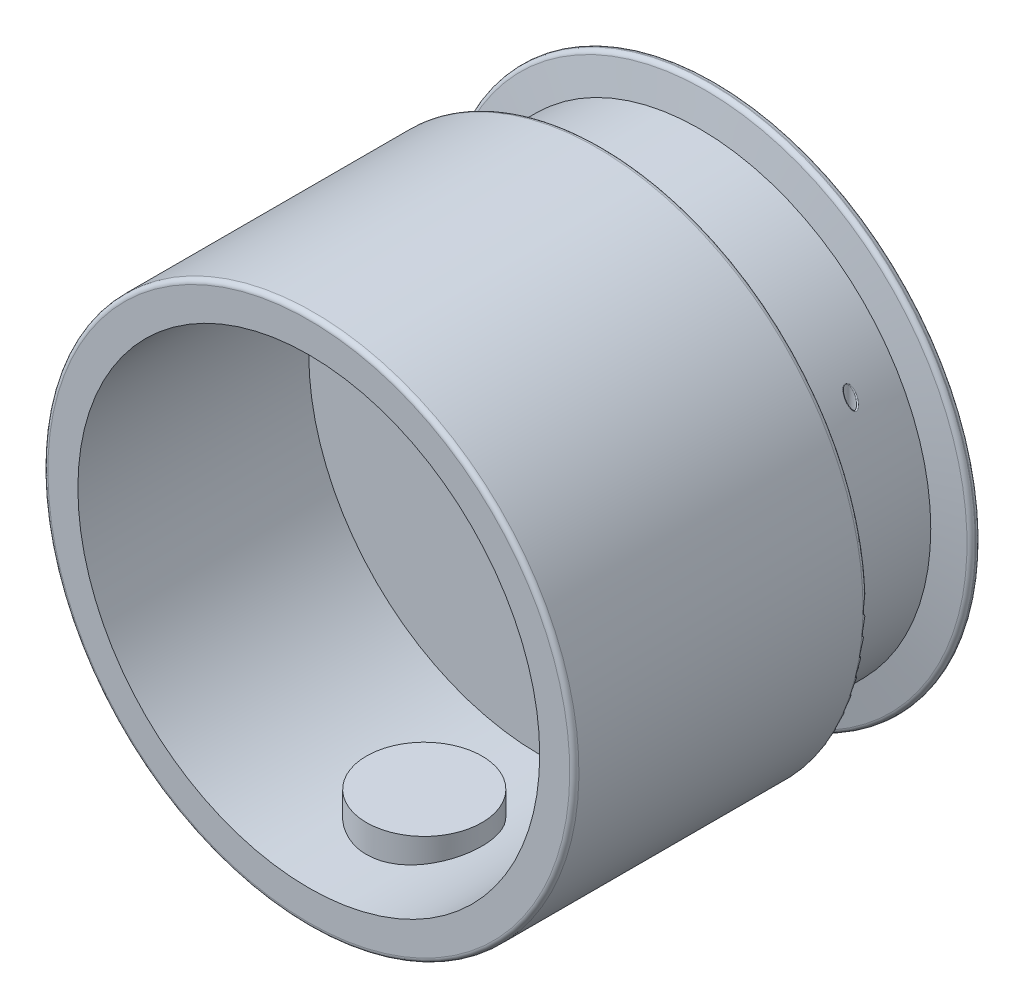
from build123d import *

# Parameters (mm, degrees)
BOSS_EXTRUDE1_REACH             = 13.742
BOSS_EXTRUDE1_DIRECTION_2_REACH = 13.742
FILLET2_R                       = 0.127
CUT_EXTRUDE1_START              = -6.35
SKETCH5_R                       = 6.35
CUT_EXTRUDE1_DEPTH              = 6.35
CHAMFER1_SIZE                   = 0.254
BOSS_EXTRUDE2_REACH             = 19.33
BOSS_EXTRUDE2_END_RADIUS        = 6.35
BOSS_EXTRUDE2_START             = -5.588
SKETCH7_R                       = 1.5875
CUT_EXTRUDE3_DEPTH              = 12.742178696
CUT_EXTRUDE3_DEPTH_BACK         = 12.742178696
SKETCH8_R                       = 0.127
FILLET4_R                       = 0.0254


with BuildPart() as part:
    # Sketch3 → Revolve1 (revolve)
    with BuildSketch(Plane(origin=(0, 0, 0), x_dir=(0, 0, -1), z_dir=(1, 0, 0))):
        Polygon((5.588, 1.7145), (-5.588, 1.7145), (-5.588, 7.3025), (2.458097102, 7.3025), (2.626048551, 6.35), (5.166048551, 6.35), (5.334, 7.3025), (5.588, 7.3025), align=None)
    revolve(axis=Axis((0, 0, 0), (0, 0, 1)))

    # Boss-Extrude1: up to this face of the body (flat: up to its plane)
    boss_extrude1_end = Plane(part.part.faces().sort_by_distance((0, -1.921045891, 5.588))[0])
    # Sketch4 → Boss-Extrude1 (add, up to the picked face)
    with BuildSketch(Plane.XY, mode=Mode.PRIVATE) as boss_extrude1_sk1:
        with BuildLine():
            Line((-1.516360854, 0.8001), (1.516360854, 0.8001))
            ThreePointArc((1.516360854, 0.8001), (0, 1.7145), (-1.516360854, 0.8001))
        make_face()
    boss_extrude1_tool1 = split(extrude(boss_extrude1_sk1.sketch, amount=BOSS_EXTRUDE1_REACH, mode=Mode.PRIVATE), bisect_by=boss_extrude1_end, keep=Keep.BOTH, mode=Mode.PRIVATE)
    add(boss_extrude1_tool1.solids().sort_by(Axis((0, 1.175768, 0), (0, 0, 1)))[0])

    # Boss-Extrude1 direction 2: up to this face of the body (flat: up to its plane)
    boss_extrude1_direction_2_end = Plane(part.part.faces().sort_by_distance((0, -7.095954109, -5.588))[0])
    # Sketch4 → Boss-Extrude1 direction 2 (add, up to the picked face)
    with BuildSketch(Plane.XY, mode=Mode.PRIVATE) as boss_extrude1_direction_2_sk1:
        with BuildLine():
            Line((-1.516360854, 0.8001), (1.516360854, 0.8001))
            ThreePointArc((1.516360854, 0.8001), (0, 1.7145), (-1.516360854, 0.8001))
        make_face()
    boss_extrude1_direction_2_tool1 = split(extrude(boss_extrude1_direction_2_sk1.sketch, amount=-BOSS_EXTRUDE1_DIRECTION_2_REACH, mode=Mode.PRIVATE), bisect_by=boss_extrude1_direction_2_end, keep=Keep.BOTH, mode=Mode.PRIVATE)
    add(boss_extrude1_direction_2_tool1.solids().sort_by(Axis((0, 1.175768, 0), (0, 0, -1)))[0])

    # Fillet2
    fillet2_edges = [part.edges().sort_by_distance(p)[0] for p in [
        (0, -7.3025, -5.588),
        (0, -7.3025, -5.334),
        (0, -7.3025, -2.458097102),
        (0, -7.3025, 5.588),
    ]]
    fillet(fillet2_edges, radius=FILLET2_R)

    # Sketch5 → Cut-Extrude1 (cut)
    with BuildSketch(Plane.XY.offset(5.588).offset(CUT_EXTRUDE1_START)):
        with Locations(Location((0, 0, 0), (0, 0, 90))):
            Circle(SKETCH5_R)
    extrude(amount=CUT_EXTRUDE1_DEPTH, mode=Mode.SUBTRACT)

    # Chamfer1
    chamfer1_edges = [part.edges().sort_by_distance(p)[0] for p in [
        (0, 0.8001, -5.588),
        (0, -1.7145, -5.588),
    ]]
    chamfer(chamfer1_edges, length=CHAMFER1_SIZE)

    # Boss-Extrude2: up to this cylinder (the profile starts inside it)
    boss_extrude2_end = Plane(origin=(0, 0, 2.413), z_dir=(0, 0, 1)) * Cylinder(BOSS_EXTRUDE2_END_RADIUS, 52.36, mode=Mode.PRIVATE)
    # Sketch7 → Boss-Extrude2 (add, up to the surface)
    with BuildSketch(Plane(origin=(0, 0, 0), x_dir=(1, 0, 0), z_dir=(0, 1, 0)).offset(BOSS_EXTRUDE2_START), mode=Mode.PRIVATE) as boss_extrude2_sk1:
        with Locations(Location((0, -2.413, 0), (0, 0, 270))):
            Circle(SKETCH7_R)
    boss_extrude2_tool1 = extrude(boss_extrude2_sk1.sketch, amount=-BOSS_EXTRUDE2_REACH, mode=Mode.PRIVATE) & boss_extrude2_end
    add(boss_extrude2_tool1.solids().sort_by_distance((0, -5.588, 2.413))[0])

    # Sketch8 → Cut-Extrude3 (cut, two sides: drawn at the far end of the back side and taken through both)
    with BuildSketch(Plane(origin=(0, 0, 0), x_dir=(1, 0, 0), z_dir=(0, 1, 0)).offset(-CUT_EXTRUDE3_DEPTH_BACK)):
        with Locations(Location((5.3975, 3.896048551, 0), (0, 0, 270))):
            Circle(SKETCH8_R)
    extrude(amount=CUT_EXTRUDE3_DEPTH + CUT_EXTRUDE3_DEPTH_BACK, mode=Mode.SUBTRACT)

    # Fillet4
    fillet4_edges = [part.edges().sort_by_distance(p)[0] for p in [
        (5.403879924, -3.33475363, -4.0228882),
        (5.403879924, 3.33475363, -4.0228882),
    ]]
    fillet(fillet4_edges, radius=FILLET4_R)


solid = part.part
